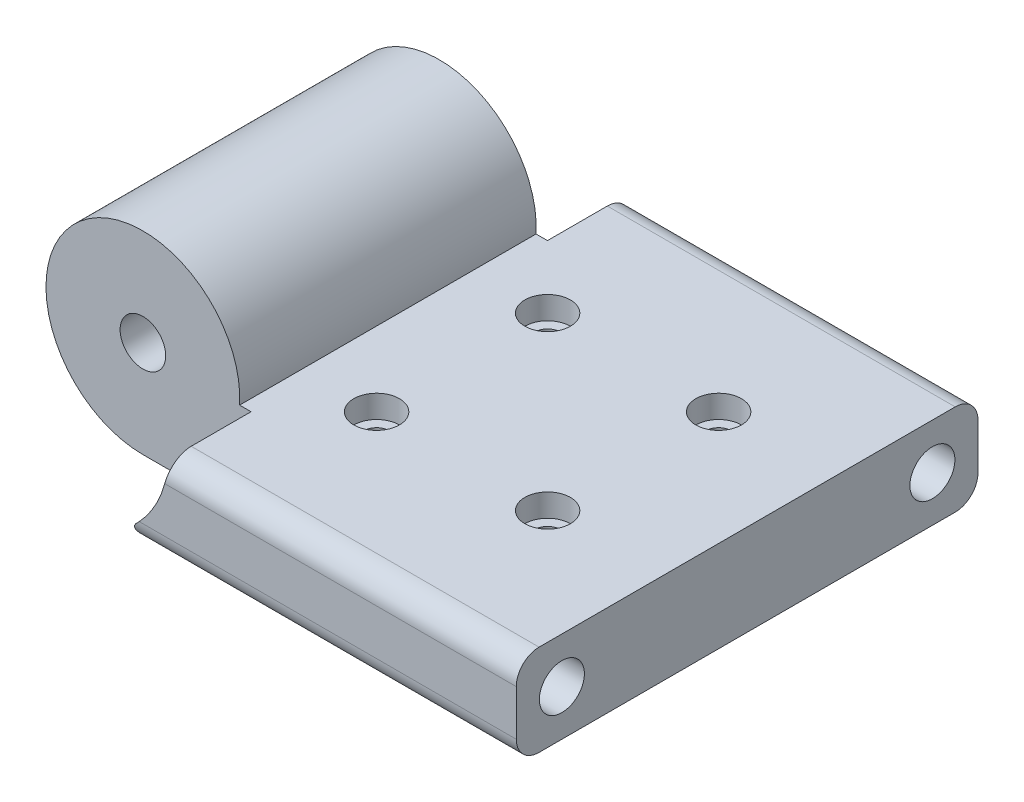
from build123d import *
from OCP.BRepFilletAPI import BRepFilletAPI_MakeFillet

# Parameters (mm, degrees)
BOSS_EXTRUDE2_DEPTH             = 40.5
SKETCH18_R                      = 19
CUT_EXTRUDE7_DEPTH              = 14.5
CUT_EXTRUDE8_REACH              = 92.73
SKETCH19_R                      = 4
SKETCH20_R                      = 3.95
CUT_EXTRUDE10_DEPTH             = 40
FILLET2_R1                      = 4
FILLET2_R2                      = 2
CBORE_FOR_M4_SHCS1_D            = 4.5
CBORE_FOR_M4_SHCS1_CBORE_D      = 8
CBORE_FOR_M4_SHCS1_CBORE_DEPTH  = 4
M3_TAPPED_HOLE1_D               = 2.5
M3_TAPPED_HOLE1_DEPTH           = 17
M3_TAPPED_HOLE1_ON_FACE_2_D     = 2.5
M3_TAPPED_HOLE1_ON_FACE_2_DEPTH = 17


with BuildPart() as part:
    # Sketch11 → Boss-Extrude2 (new body)
    with BuildSketch(Plane.XY):
        with BuildLine():
            Line((0, 0), (80, 0))
            Line((80, 0), (80, 16))
            Line((80, 16), (16.970562748, 16))
            ThreePointArc((16.970562748, 16), (-11.66190379, 29.369316877), (0, 0))
        make_face()
    boss_extrude2 = extrude(amount=-BOSS_EXTRUDE2_DEPTH)

    # Sketch18 → Cut-Extrude7 (cut)
    with BuildSketch(Plane.XY):
        with Locations((0, 17)):
            Circle(SKETCH18_R)
    cut_extrude7 = extrude(amount=-CUT_EXTRUDE7_DEPTH, mode=Mode.SUBTRACT)

    # Sketch19 → Cut-Extrude8 (cut, up to next)
    with BuildSketch(Plane.XY.offset(-14.5), mode=Mode.PRIVATE) as cut_extrude8_sk1:
        with Locations((0, 17)):
            Circle(SKETCH19_R)
    cut_extrude8_tool1 = extrude(cut_extrude8_sk1.sketch, amount=-CUT_EXTRUDE8_REACH, mode=Mode.PRIVATE) & part.part
    cut_extrude8 = cut_extrude8_tool1.solids().sort_by_distance((0, 17, -14.5))[0]
    add(cut_extrude8, mode=Mode.SUBTRACT)

    # Sketch20 → Cut-Extrude10 (cut)
    with BuildSketch(Plane(origin=(80, 0, 0), x_dir=(0, 0, -1), z_dir=(1, 0, 0))):
        with Locations((8, 8)):
            Circle(SKETCH20_R)
    cut_extrude10 = extrude(amount=-CUT_EXTRUDE10_DEPTH, mode=Mode.SUBTRACT)

    # Mirror2: Boss-Extrude2, Cut-Extrude7, Cut-Extrude8, Cut-Extrude10 across plane
    add(boss_extrude2.mirror(Plane(origin=(0, 17, -40.5), x_dir=(1, 0, 0), z_dir=(0, 0, -1))))
    add(cut_extrude7.mirror(Plane(origin=(0, 17, -40.5), x_dir=(1, 0, 0), z_dir=(0, 0, -1))), mode=Mode.SUBTRACT)
    add(cut_extrude8.mirror(Plane(origin=(0, 17, -40.5), x_dir=(1, 0, 0), z_dir=(0, 0, -1))), mode=Mode.SUBTRACT)
    add(cut_extrude10.mirror(Plane(origin=(0, 17, -40.5), x_dir=(1, 0, 0), z_dir=(0, 0, -1))), mode=Mode.SUBTRACT)

    # Fillet2: one fillet with a radius per group of edges: ONE call of the kernel's fillet builder (fillet() takes one radius for all edges)
    fillet2_edges_1 = [part.edges().sort_by_distance(p)[0] for p in [
        (44.242640687, 0, 0),
        (49.486832981, 16, -81),
        (49.486832981, 16, 0),
        (44.242640687, 0, -81),
    ]]
    fillet2_edges_2 = [part.edges().sort_by_distance(p)[0] for p in [
        (8.485281374, 0, -7.25),
        (8.485281374, 0, -73.75),
    ]]
    fillet2 = BRepFilletAPI_MakeFillet(part.part.solid().wrapped)
    for e in fillet2_edges_1:
        fillet2.Add(FILLET2_R1, e.wrapped)
    for e in fillet2_edges_2:
        fillet2.Add(FILLET2_R2, e.wrapped)
    add(Compound.cast(fillet2.Shape()), mode=Mode.REPLACE)

    # CBORE for M4 SHCS1 (through all)
    with Locations(Plane(origin=(0, 16, 0), x_dir=(1, 0, 0), z_dir=(0, 1, 0))):
        with Locations((60, 55.5), (60, 25.5), (30, 25.5), (30, 55.5)):
            CounterBoreHole(CBORE_FOR_M4_SHCS1_D / 2, CBORE_FOR_M4_SHCS1_CBORE_D / 2, CBORE_FOR_M4_SHCS1_CBORE_DEPTH)

    # M3 Tapped Hole1
    with Locations(Plane(origin=(-8.5, 2.277568136, -58.5), x_dir=(-0.866025403784, 0.5, 0), z_dir=(-0.5, -0.866025403784, 0))):
        with Locations((0, 0)):
            Hole(M3_TAPPED_HOLE1_D / 2, depth=M3_TAPPED_HOLE1_DEPTH)

    # M3 Tapped Hole1 on face 2
    with Locations(Plane(origin=(-8.5, 2.277568136, -22.5), x_dir=(-0.866025302838, 0.500000174844, 0), z_dir=(-0.500000174844, -0.866025302838, 0))):
        with Locations((0, 0)):
            Hole(M3_TAPPED_HOLE1_ON_FACE_2_D / 2, depth=M3_TAPPED_HOLE1_ON_FACE_2_DEPTH)


solid = part.part
